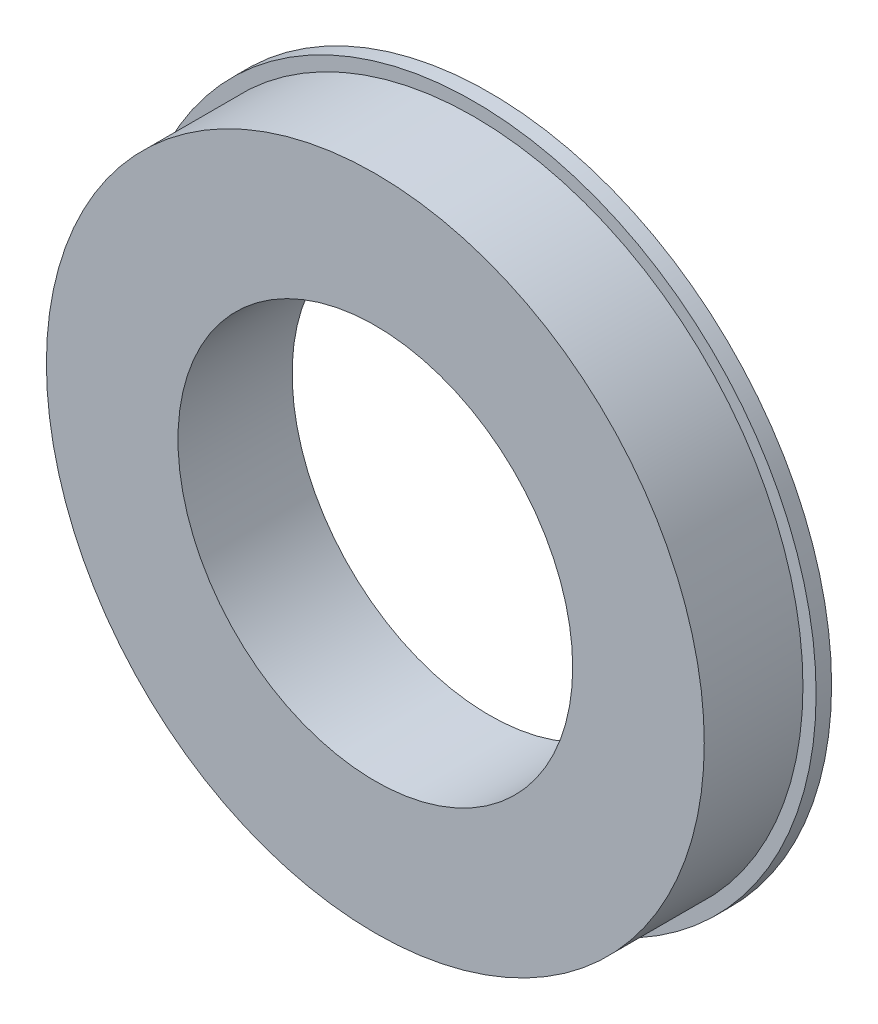
from build123d import *

# Parameters (mm, degrees)
SKETCH1_W = 2.99
SKETCH1_H = 2.54


with BuildPart() as part:
    # Sketch1 → Revolve1 (revolve)
    with BuildSketch(Plane(origin=(0, 0, 0), x_dir=(0, 0, -1), z_dir=(1, 0, 0)), mode=Mode.PRIVATE) as revolve1_sk:
        Polygon((0, 63.5), (0, 38.1), (22.04, 38.1), (22.04, 63.5), (19.05, 63.5), align=None)
        with Locations((20.545, 64.77)):
            Rectangle(SKETCH1_W, SKETCH1_H)
    revolve(revolve1_sk.sketch.rotate(Axis((0, 0, 105.875247525), (0, 0, -1)), 90), axis=Axis((0, 0, 105.875247525), (0, 0, -1)))


solid = part.part
